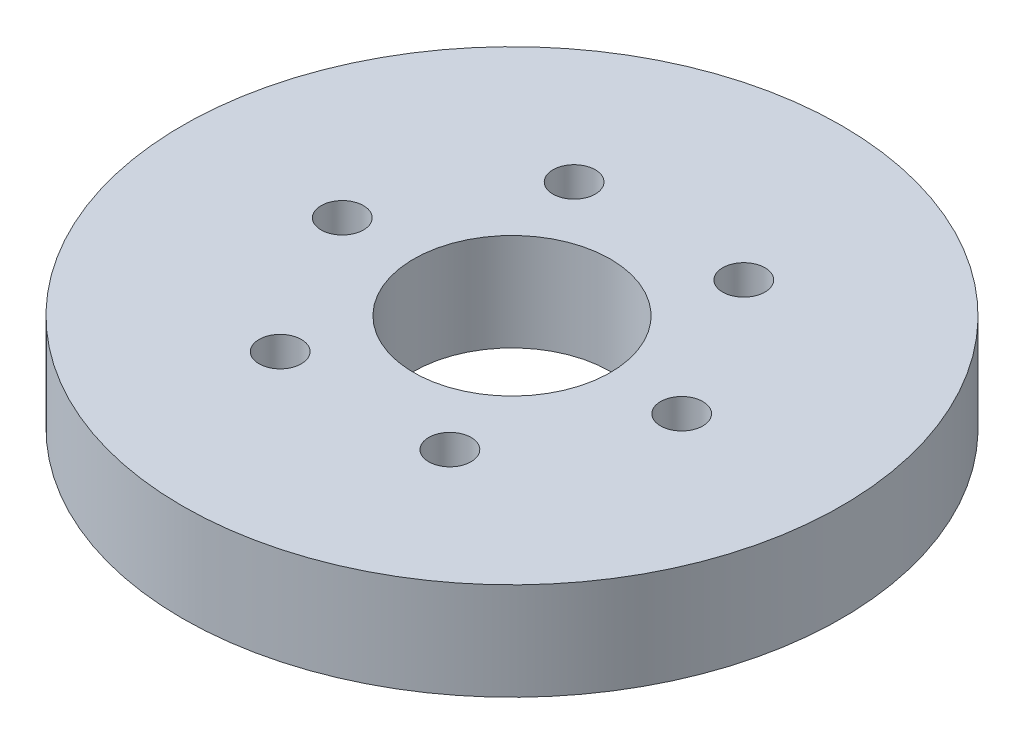
from build123d import *

# Parameters (mm, degrees)
SKETCH_1_R          = 33.5
SKETCH_1_R_2        = 2.15
SKETCH_1_R_3        = 10
EXTRUDE_1_DEPTH     = 9.9
SKETCH_2_R          = 5
CUT_EXTRUDE_3_DEPTH = 2.5
SKETCH_5_R          = 5
CUT_EXTRUDE_5_DEPTH = 2


with BuildPart() as part:
    # 草图1 → 凸台-拉伸1 (new body)
    with BuildSketch(Plane(origin=(0, 0, 0), x_dir=(1, 0, 0), z_dir=(0, 1, 0))):
        with Locations(Location((0, 0, 0), (0, 0, 90))):
            Circle(SKETCH_1_R)
        with Locations(Location((8.625, 14.938938215, 0), (0, 0, 90))):
            Circle(SKETCH_1_R_2, mode=Mode.SUBTRACT)
        with Locations(Location((0, 0, 0), (0, 0, 90))):
            Circle(SKETCH_1_R_3, mode=Mode.SUBTRACT)
        with Locations(Location((17.25, 0, 0), (0, 0, 90))):
            Circle(SKETCH_1_R_2, mode=Mode.SUBTRACT)
        with Locations(Location((8.625, -14.938938215, 0), (0, 0, 90))):
            Circle(SKETCH_1_R_2, mode=Mode.SUBTRACT)
        with Locations(Location((-8.625, -14.938938215, 0), (0, 0, 90))):
            Circle(SKETCH_1_R_2, mode=Mode.SUBTRACT)
        with Locations(Location((-17.25, 0, 0), (0, 0, 90))):
            Circle(SKETCH_1_R_2, mode=Mode.SUBTRACT)
        with Locations(Location((-8.625, 14.938938215, 0), (0, 0, 90))):
            Circle(SKETCH_1_R_2, mode=Mode.SUBTRACT)
    extrude(amount=EXTRUDE_1_DEPTH)

    # 草图2 → 切除-拉伸3 (cut)
    with BuildSketch(Plane(origin=(0, 0, 0), x_dir=(1, 0, 0), z_dir=(0, 1, 0))):
        with Locations(Location((0, -27, 0), (0, 0, 90))):
            Circle(SKETCH_2_R)
    extrude(amount=CUT_EXTRUDE_3_DEPTH, mode=Mode.SUBTRACT)

    # 草图5 → 切除-拉伸5 (cut)
    with BuildSketch(Plane.XZ):
        with Locations(Location((8.625, 14.938938215, 0), (0, 0, 270))):
            Circle(SKETCH_5_R)
        with Locations(Location((17.25, 0, 0), (0, 0, 270))):
            Circle(SKETCH_5_R)
        with Locations(Location((8.625, -14.938938215, 0), (0, 0, 270))):
            Circle(SKETCH_5_R)
    extrude(amount=-CUT_EXTRUDE_5_DEPTH, mode=Mode.SUBTRACT)


solid = part.part
